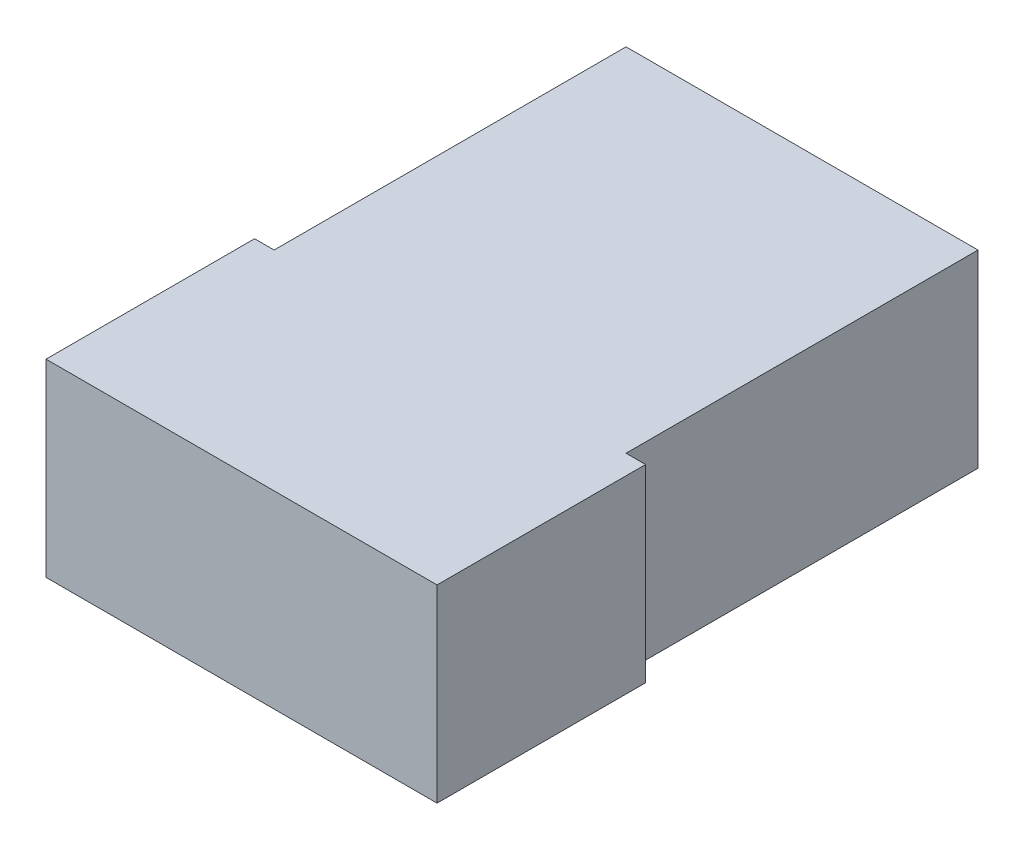
from build123d import *

# Parameters (mm, degrees)
LID_BLOCK_START      = 48
SKETCH1_W            = 27
SKETCH1_H            = 27
LID_BLOCK_DEPTH      = 14.5
MAGNET_EAR_START     = 48
SKETCH2_W            = 30
SKETCH2_H            = 16
MAGNET_EAR_DEPTH     = 14.5
SKIRT_RECESS_START   = 48
SKETCH3_W            = 23.4
SKETCH3_H            = 23.4
SKIRT_RECESS_DEPTH   = 6
CUVETTE_CAVITY_START = 54
SKETCH4_W            = 15
SKETCH4_H            = 15
CUVETTE_CAVITY_DEPTH = 5.5
MAGNET_POCKET_START  = 48
SKETCH5_W            = 27.4
SKETCH5_H            = 14.4
MAGNET_POCKET_DEPTH  = 8.2


with BuildPart() as part:
    # Sketch1 → Lid_Block (new body)
    with BuildSketch(Plane(origin=(0, 0, 0), x_dir=(1, 0, 0), z_dir=(0, 1, 0)).offset(LID_BLOCK_START)):
        Rectangle(SKETCH1_W, SKETCH1_H)
    extrude(amount=LID_BLOCK_DEPTH)

    # Sketch2 → Magnet_Ear (add)
    with BuildSketch(Plane(origin=(0, 0, 0), x_dir=(1, 0, 0), z_dir=(0, 1, 0)).offset(MAGNET_EAR_START)):
        with Locations((0, -21.5)):
            Rectangle(SKETCH2_W, SKETCH2_H)
    extrude(amount=MAGNET_EAR_DEPTH)

    # Sketch3 → Skirt_Recess (cut)
    with BuildSketch(Plane(origin=(0, 0, 0), x_dir=(1, 0, 0), z_dir=(0, 1, 0)).offset(SKIRT_RECESS_START)):
        Rectangle(SKETCH3_W, SKETCH3_H)
    extrude(amount=SKIRT_RECESS_DEPTH, mode=Mode.SUBTRACT)

    # Sketch4 → Cuvette_Cavity (cut)
    with BuildSketch(Plane(origin=(0, 0, 0), x_dir=(1, 0, 0), z_dir=(0, 1, 0)).offset(CUVETTE_CAVITY_START)):
        Rectangle(SKETCH4_W, SKETCH4_H)
    extrude(amount=CUVETTE_CAVITY_DEPTH, mode=Mode.SUBTRACT)

    # Sketch5 → Magnet_Pocket (cut)
    with BuildSketch(Plane(origin=(0, 0, 0), x_dir=(1, 0, 0), z_dir=(0, 1, 0)).offset(MAGNET_POCKET_START)):
        with Locations((0, -21.5)):
            Rectangle(SKETCH5_W, SKETCH5_H)
    extrude(amount=MAGNET_POCKET_DEPTH, mode=Mode.SUBTRACT)


solid = part.part
